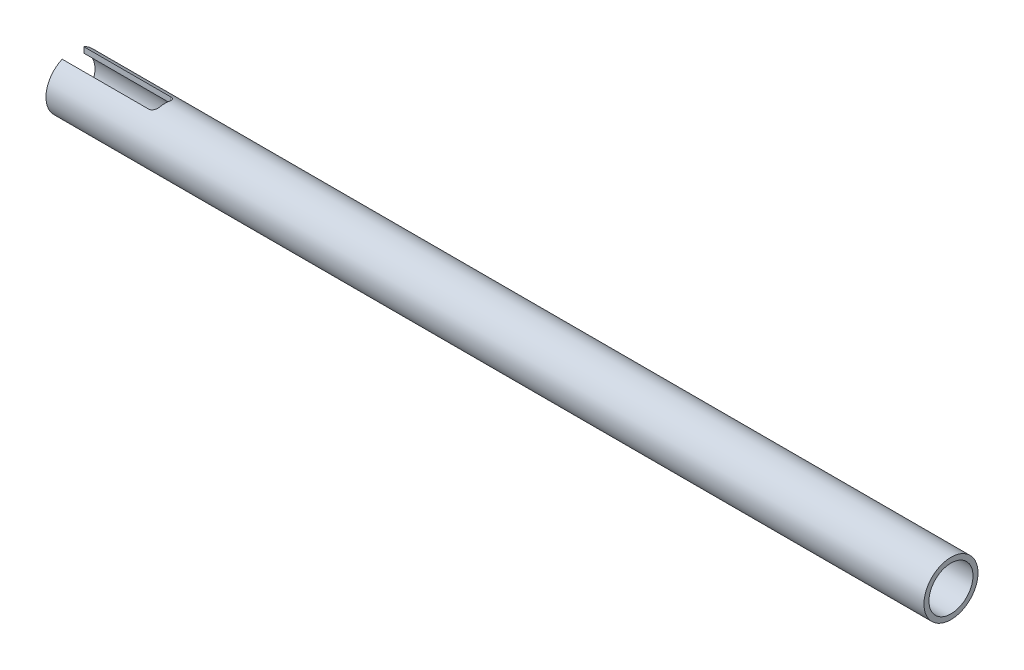
from build123d import *

# Parameters (mm, degrees)
BOSS_EXTRUDE1_DEPTH      = 153.61996
BOSS_EXTRUDE1_DEPTH_BACK = 104.21574
SKETCH1_R                = 7.9375
SKETCH1_R_2              = 6.4643
CUT_EXTRUDE1_DEPTH       = 155.641881913
FILLET1_R                = 1.5875


with BuildPart() as part:
    # Sketch1 → Boss-Extrude1 (new, two sides: drawn at the far end of the back side and taken through both)
    with BuildSketch(Plane(origin=(0, 0, 0), x_dir=(0, 0, -1), z_dir=(1, 0, 0)).offset(-BOSS_EXTRUDE1_DEPTH_BACK)):
        with Locations(Location((0, 0, 0), (0, 0, 270))):
            Circle(SKETCH1_R)
        with Locations(Location((0, 0, 0), (0, 0, 270))):
            Circle(SKETCH1_R_2, mode=Mode.SUBTRACT)
    extrude(amount=BOSS_EXTRUDE1_DEPTH + BOSS_EXTRUDE1_DEPTH_BACK)

    # Sketch2 → Cut-Extrude1 (cut, through all)
    with BuildSketch(Plane(origin=(0, 7.9375, 0), x_dir=(1, 0, 0), z_dir=(0, 1, 0))):
        Polygon((-80.403240171, 3.175), (-112.470740171, 3.175), (-112.470740171, -3.175), (-80.403240171, -3.175), (-78.815740171, -3.175), (-77.228240171, -3.175), (-77.228240171, 3.175), (-78.815740171, 3.175), align=None)
    extrude(amount=-CUT_EXTRUDE1_DEPTH, mode=Mode.SUBTRACT)

    # Fillet1
    fillet1_edges = [part.edges().sort_by_distance(p)[0] for p in [
        (-77.228240171, -6.452847911, -3.175),
        (-77.228240171, 6.452847911, -3.175),
        (-77.228240171, 6.452847911, 3.175),
        (-77.228240171, -6.452847911, 3.175),
    ]]
    fillet(fillet1_edges, radius=FILLET1_R)


solid = part.part
